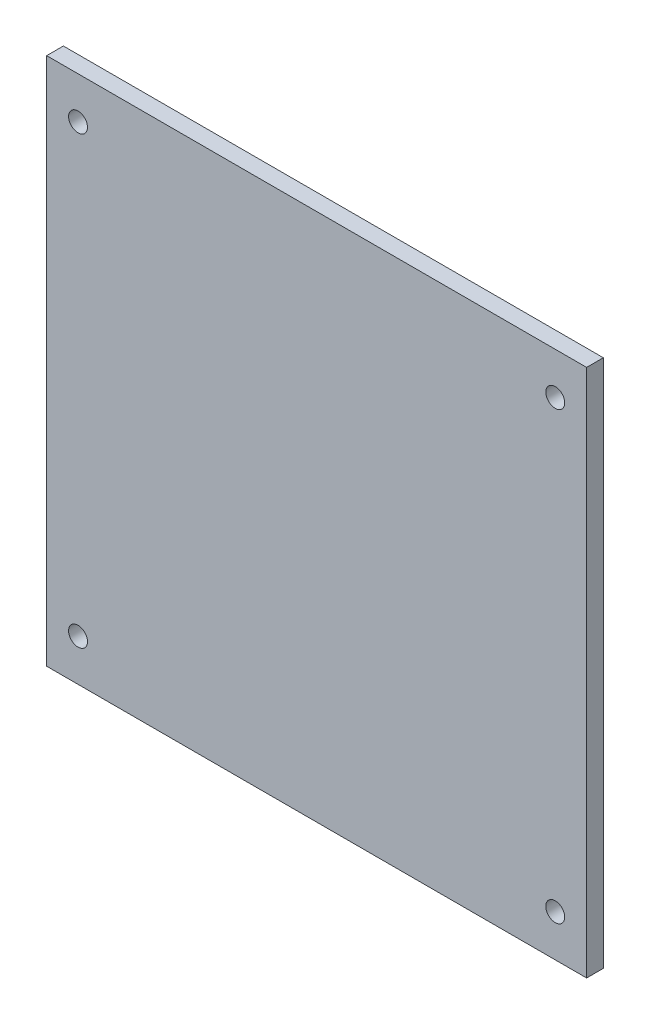
from build123d import *

# Parameters (mm, degrees)
BODY_SKETCH_W    = 97
BODY_SKETCH_H    = 95
BODY_DEPTH       = 3
HOLES_DEPTH      = 136.805007271
HOLES_DEPTH_BACK = 136.805007271
HOLES_SKETCH_R   = 1.7


with BuildPart() as part:
    # Body sketch → Body (new body)
    with BuildSketch(Plane.XY):
        with Locations((48.5, 47.5)):
            Rectangle(BODY_SKETCH_W, BODY_SKETCH_H)
    extrude(amount=BODY_DEPTH)

    # Holes sketch → Holes (cut, two sides: drawn at the far end of the back side and taken through both)
    with BuildSketch(Plane.XY.offset(-HOLES_DEPTH_BACK)):
        with Locations((5.635, 7.495)):
            Circle(HOLES_SKETCH_R)
        with Locations((91.365, 7.495)):
            Circle(HOLES_SKETCH_R)
        with Locations((5.635, 87.505)):
            Circle(HOLES_SKETCH_R)
        with Locations((91.365, 87.505)):
            Circle(HOLES_SKETCH_R)
    extrude(amount=HOLES_DEPTH + HOLES_DEPTH_BACK, mode=Mode.SUBTRACT)


solid = part.part
